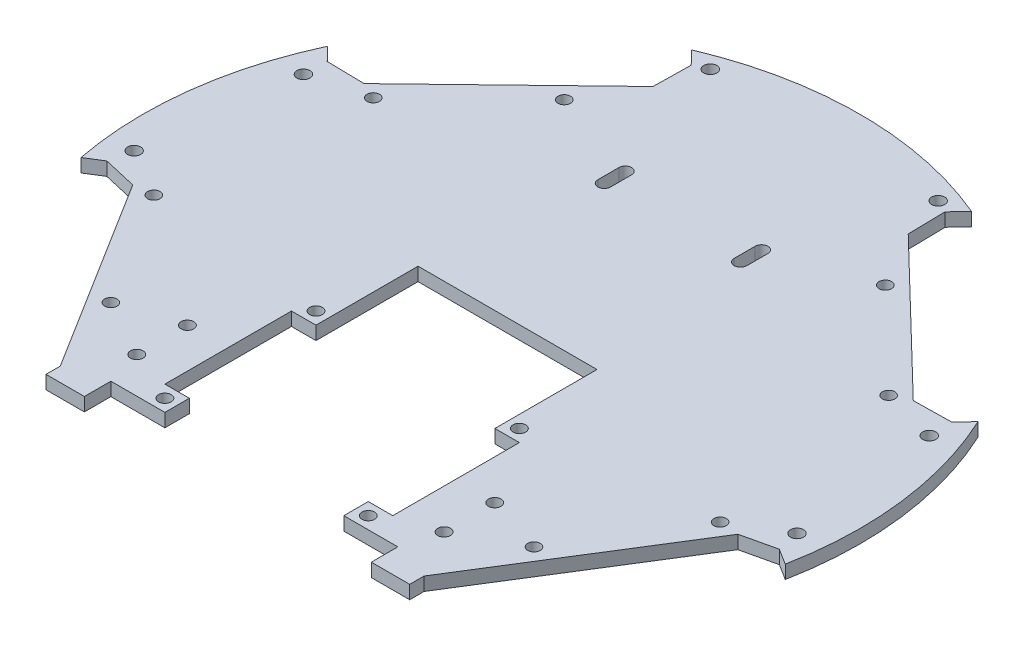
from build123d import *

# Parameters (mm, degrees)
BOSS_EXTRUDE4_DEPTH  = 3.175
M3_CLEARANCE_HOLE3_D = 3
M3_CLEARANCE_HOLE1_D = 3.1
M3_CLEARANCE_HOLE4_D = 2.95
M3_CLEARANCE_HOLE2_D = 3.1
CUT_EXTRUDE1_DEPTH   = 121.250075364
BOSS_EXTRUDE6_DEPTH  = 3.175
CUT_EXTRUDE3_DEPTH   = 121.250075364
SKETCH25_R           = 1.5
CUT_EXTRUDE4_DEPTH   = 121.250075364


with BuildPart() as part:
    # Sketch1 → Boss-Extrude4 (new body)
    with BuildSketch(Plane(origin=(0, 0, 0), x_dir=(1, 0, 0), z_dir=(0, 1, 0))):
        with BuildLine():
            Line((-62.799553621, 32.496136604), (-73.969425011, 32.691107434))
            Line((-73.969425011, 32.691107434), (-77.053684287, 35.88495141))
            ThreePointArc((-77.053684287, 35.88495141), (-84.36642289, 10.358894189), (-83.446216027, -16.178041625))
            Line((-83.446216027, -16.178041625), (-79.680911643, -13.825218315))
            Line((-79.680911643, -13.825218315), (-69.484649137, -16.179210996))
            Line((-69.484649137, -16.179210996), (-43.094490772, -58.412292655))
            Line((-43.094490772, -58.412292655), (-43.094490772, -64.826600275))
            Line((-43.094490772, -64.826600275), (-34, -64.826600275))
            Line((-34, -64.826600275), (-34, -58.55))
            Line((-34, -58.55), (34, -58.55))
            Line((34, -58.55), (34, -64.826600275))
            Line((34, -64.826600275), (43.094490772, -64.826600275))
            Line((43.094490772, -64.826600275), (43.094490772, -58.412292655))
            Line((43.094490772, -58.412292655), (69.484649137, -16.179210996))
            Line((69.484649137, -16.179210996), (79.680911643, -13.825218315))
            Line((79.680911643, -13.825218315), (83.446216027, -16.178041625))
            ThreePointArc((83.446216027, -16.178041625), (84.36642289, 10.358894189), (77.053684287, 35.88495141))
            Line((77.053684287, 35.88495141), (73.969425011, 32.691107434))
            Line((73.969425011, 32.691107434), (62.799553621, 32.496136604))
            Line((62.799553621, 32.496136604), (30.284668021, 63.895396642))
            Line((30.284668021, 63.895396642), (30.089697191, 75.065268032))
            Line((30.089697191, 75.065268032), (33.173956467, 78.259112008))
            ThreePointArc((33.173956467, 78.259112008), (0, 85), (-33.173956467, 78.259112008))
            Line((-33.173956467, 78.259112008), (-30.089697191, 75.065268032))
            Line((-30.089697191, 75.065268032), (-30.284668021, 63.895396642))
            Line((-30.284668021, 63.895396642), (-62.799553621, 32.496136604))
        make_face()
    extrude(amount=BOSS_EXTRUDE4_DEPTH)

    # M3 Clearance Hole3 (through all)
    with Locations(Plane(origin=(0, 0, 0), x_dir=(-1, 0, 0), z_dir=(0, -1, 0))):
        with Locations((36.415, -50), (36.415, -38), (-36.415, -50), (-36.415, -38)):
            Hole(M3_CLEARANCE_HOLE3_D / 2)

    # M3 Clearance Hole1 (through all)
    with Locations(Plane(origin=(0, 3.175, 0), x_dir=(1, 0, 0), z_dir=(0, 1, 0))):
        with Locations((-78.542321426, -8.49139241), (78.542321426, -8.49139241), (74.155025063, 27.240269049), (-74.155025063, 27.240269049)):
            Hole(M3_CLEARANCE_HOLE1_D / 2)

    # M3 Clearance Hole4 (through all)
    with Locations(Plane(origin=(0, 0, 0), x_dir=(-1, 0, 0), z_dir=(0, -1, 0))):
        with Locations((-67.099301622, -15.278865202), (-50.141885166, -42.416404279), (-61.062544382, 30.698137949), (-38.043670771, 52.927205804), (50.141885166, -42.416404279), (67.099301622, -15.278865202), (38.043670771, 52.927205804), (61.062544382, 30.698137949)):
            Hole(M3_CLEARANCE_HOLE4_D / 2)

    # M3 Clearance Hole2 (through all)
    with Locations(Plane(origin=(0, 3.175, 0), x_dir=(1, 0, 0), z_dir=(0, 1, 0))):
        with Locations((27, 76.497766718), (-27, 76.497766718)):
            Hole(M3_CLEARANCE_HOLE2_D / 2)

    # Sketch20 → Cut-Extrude1 (cut, through all)
    with BuildSketch(Plane(origin=(0, 3.175, 0), x_dir=(1, 0, 0), z_dir=(0, 1, 0))):
        with BuildLine():
            Line((-14.64850035, 45.5), (-14.64850035, 40.5))
            ThreePointArc((-14.64850035, 40.5), (-16.14850035, 39), (-17.64850035, 40.5))
            Line((-17.64850035, 40.5), (-17.64850035, 45.5))
            ThreePointArc((-17.64850035, 45.5), (-16.14850035, 47), (-14.64850035, 45.5))
        make_face()
        with BuildLine():
            Line((14.64850035, 45.5), (14.64850035, 40.5))
            ThreePointArc((14.64850035, 40.5), (16.14850035, 39), (17.64850035, 40.5))
            Line((17.64850035, 40.5), (17.64850035, 45.5))
            ThreePointArc((17.64850035, 45.5), (16.14850035, 47), (14.64850035, 45.5))
        make_face()
    extrude(amount=-CUT_EXTRUDE1_DEPTH, mode=Mode.SUBTRACT)

    # Sketch22 → Boss-Extrude6 (add)
    with BuildSketch(Plane(origin=(0, 3.175, 0), x_dir=(1, 0, 0), z_dir=(0, 1, 0))):
        Polygon((-30.284668021, 63.895396642), (-30.245177733, 66.157793715), (-65.061950694, 32.535626892), (-62.799553621, 32.496136604), align=None)
        Polygon((-69.484649137, -16.179210996), (-71.689396914, -15.670204865), (-43.094490772, -61.431620518), (-43.094490772, -58.412292655), align=None)
        Polygon((43.094490772, -61.431620518), (71.689396914, -15.670204865), (69.484649137, -16.179210996), (43.094490772, -58.412292655), align=None)
        Polygon((65.061950694, 32.535626892), (30.245177733, 66.157793715), (30.284668021, 63.895396642), (62.799553621, 32.496136604), align=None)
    extrude(amount=-BOSS_EXTRUDE6_DEPTH)

    # Sketch24 → Cut-Extrude3 (cut, through all)
    with BuildSketch(Plane(origin=(0, 3.175, 0), x_dir=(1, 0, 0), z_dir=(0, 1, 0))):
        Polygon((-27, -52.75), (-27, -22.75), (-21.2, -22.75), (-21.2, 1.45), (0, 1.45), (21.2, 1.45), (21.2, -22.75), (27, -22.75), (27, -52.75), (21.2, -52.75), (21.2, -58.55), (-21.2, -58.55), (-21.2, -52.75), align=None)
    extrude(amount=-CUT_EXTRUDE3_DEPTH, mode=Mode.SUBTRACT)

    # Sketch25 → Cut-Extrude4 (cut, through all)
    with BuildSketch(Plane(origin=(0, 3.175, 0), x_dir=(1, 0, 0), z_dir=(0, 1, 0))):
        with Locations(Location((-24.1, -55.65, 0), (0, 0, 270))):
            Circle(SKETCH25_R)
        with Locations(Location((-24.1, -19.85, 0), (0, 0, 270))):
            Circle(SKETCH25_R)
        with Locations(Location((24.1, -19.85, 0), (0, 0, 270))):
            Circle(SKETCH25_R)
        with Locations(Location((24.1, -55.65, 0), (0, 0, 270))):
            Circle(SKETCH25_R)
    extrude(amount=-CUT_EXTRUDE4_DEPTH, mode=Mode.SUBTRACT)


solid = part.part
